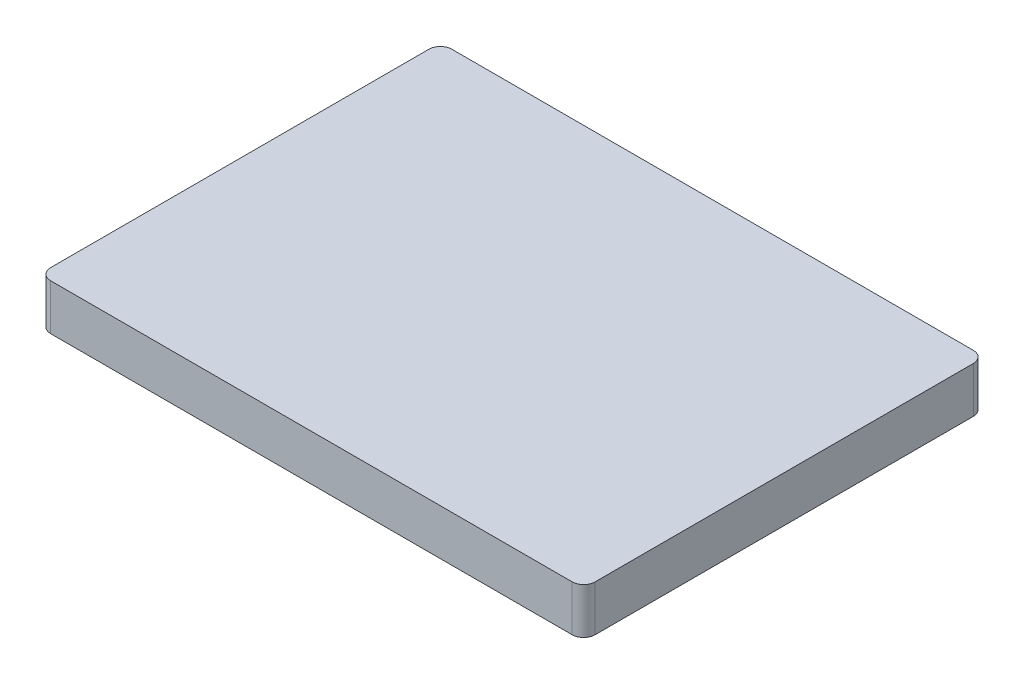
from build123d import *

# Parameters (mm, degrees)
EXTRUDE_1_DEPTH = 8


with BuildPart() as part:
    # 草圖1 → 填料-伸長1 (new body)
    with BuildSketch(Plane(origin=(0, 0, 0), x_dir=(1, 0, 0), z_dir=(0, 1, 0))):
        with BuildLine():
            Line((2, 0), (93, 0))
            ThreePointArc((93, 0), (94.414213562, 0.585786438), (95, 2))
            Line((95, 2), (95, 68))
            ThreePointArc((95, 68), (94.414213562, 69.414213562), (93, 70))
            Line((93, 70), (2, 70))
            ThreePointArc((2, 70), (0.585786438, 69.414213562), (0, 68))
            Line((0, 68), (0, 2))
            ThreePointArc((0, 2), (0.585786438, 0.585786438), (2, 0))
        make_face()
    extrude(amount=EXTRUDE_1_DEPTH)


solid = part.part
